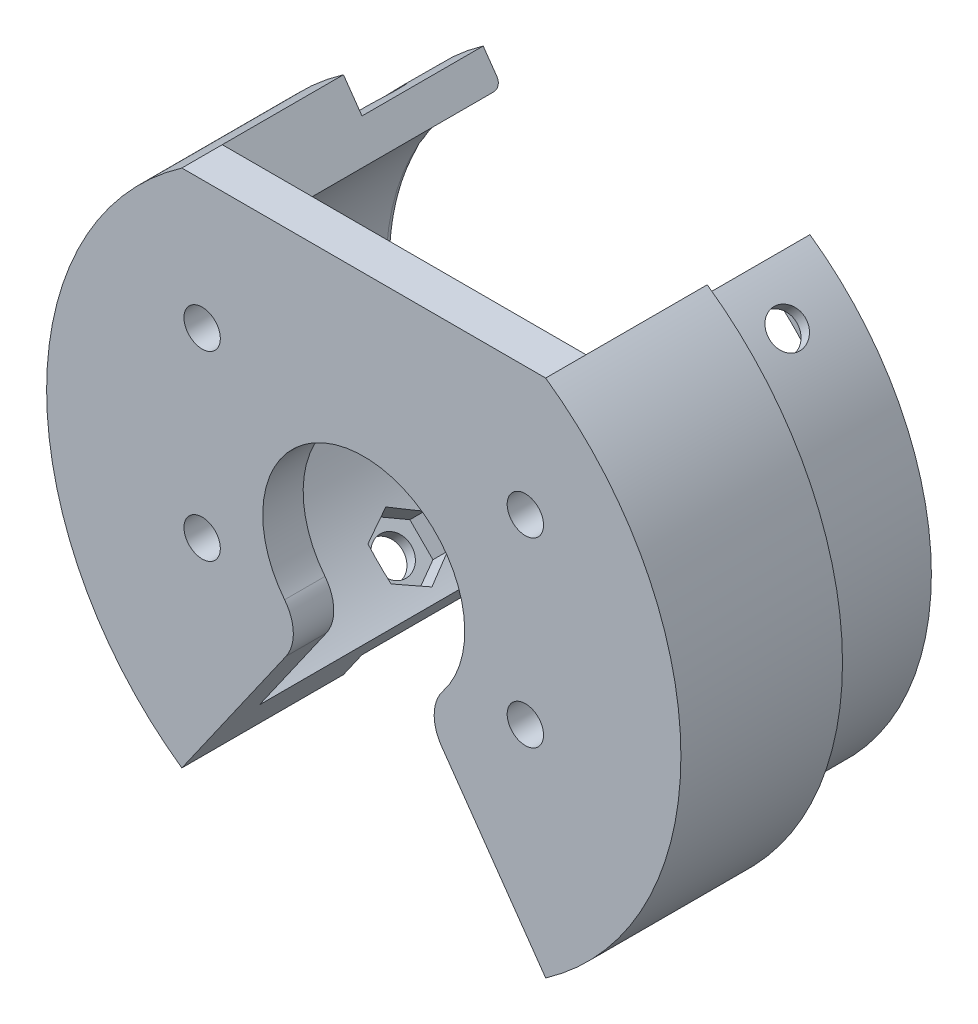
from build123d import *
from build123d.topology import SkipClean

# Parameters (mm, degrees)
SKETCH1_R               = 35.25
SKETCH1_R_2             = 31.25
BOSS_EXTRUDE1_DEPTH     = 7.5
CUT_EXTRUDE1_DEPTH      = 51.412052
BOSS_EXTRUDE2_DEPTH     = 15
BOSS_EXTRUDE3_DEPTH     = 5
CUT_EXTRUDE2_START      = -10
SKETCH8_R               = 2.25
CUT_EXTRUDE2_DEPTH      = 97.386619
CUT_EXTRUDE3_START      = -10
CUT_EXTRUDE3_DEPTH      = 12.5
MIRROR3_START           = -10
MIRROR3_COPY_1_SKETCH_R = 2.25
MIRROR3_COPY_1_DEPTH    = 97.386619
MIRROR3_COPY_2_DEPTH    = 12.5
CUT_EXTRUDE4_DEPTH      = 62.638425
CUT_EXTRUDE4_DEPTH_BACK = 62.638425
FILLET1_R               = 5
SKETCH11_R              = 2.25
EXAMPLE_MOUNT_DEPTH     = 62.638425
FILLET2_R               = 1


with BuildPart() as part:
    # Sketch1 → Boss-Extrude1 (new, symmetric)
    with BuildSketch(Plane.XY):
        Circle(SKETCH1_R)
        Circle(SKETCH1_R_2, mode=Mode.SUBTRACT)
    extrude(amount=BOSS_EXTRUDE1_DEPTH, both=True)

    # Sketch2 → Cut-Extrude1 (cut, symmetric)
    with BuildSketch(Plane.XY):
        with BuildLine():
            Line((20.218569, 28.87511), (17.924264, 25.598501))
            ThreePointArc((17.924264, 25.598501), (0, 31.25), (-17.924264, 25.598501))
            Line((-17.924264, 25.598501), (-20.218569, 28.87511))
            ThreePointArc((-20.218569, 28.87511), (0, 35.25), (20.218569, 28.87511))
        make_face()
    cut_extrude1 = extrude(amount=CUT_EXTRUDE1_DEPTH, both=True, mode=Mode.SUBTRACT)

    # Mirror1: Cut-Extrude1 across plane
    add(cut_extrude1.mirror(Plane.ZX), mode=Mode.SUBTRACT)

    # Sketch3 → Boss-Extrude2 (add)
    with SkipClean():  # the faces are left unmerged after this step: merging them gives an invalid solid
        with BuildSketch(Plane.XY.offset(7.5)):
            with BuildLine():
                Line((-17.924264, 25.598501), (-22.512875, 32.151718))
                ThreePointArc((-22.512875, 32.151718), (-39.25, 0), (-22.512875, -32.151718))
                Line((-22.512875, -32.151718), (-17.924264, -25.598501))
                ThreePointArc((-17.924264, -25.598501), (-31.25, 0), (-17.924264, 25.598501))
            make_face()
            with BuildLine():
                Line((17.924264, -25.598501), (22.512875, -32.151718))
                ThreePointArc((22.512875, -32.151718), (39.25, 0), (22.512875, 32.151718))
                Line((22.512875, 32.151718), (17.924264, 25.598501))
                ThreePointArc((17.924264, 25.598501), (31.25, 0), (17.924264, -25.598501))
            make_face()
        extrude(amount=BOSS_EXTRUDE2_DEPTH)

    # Sketch4 → Boss-Extrude3 (add)
    with SkipClean():  # the faces are left unmerged after this step: merging them gives an invalid solid
        with BuildSketch(Plane.XY.offset(22.5)):
            with BuildLine():
                Line((22.512875, 32.151718), (-22.512875, 32.151718))
                ThreePointArc((-22.512875, 32.151718), (-39.25, 0), (-22.512875, -32.151718))
                Line((-22.512875, -32.151718), (22.512875, -32.151718))
                ThreePointArc((22.512875, -32.151718), (39.25, 0), (22.512875, 32.151718))
            make_face()
        extrude(amount=BOSS_EXTRUDE3_DEPTH)

    # Sketch8 → Cut-Extrude2 (cut)
    with SkipClean():  # the faces are left unmerged after this step: merging them gives an invalid solid
        with BuildSketch(Plane(origin=(22.097087, 22.097087, 0), x_dir=(0.7071067811865486, -0.7071067811865465, 0), z_dir=(0.7071067811865465, 0.7071067811865486, 0)).offset(CUT_EXTRUDE2_START)):
            with Locations(Location((0, 0, 0), (0, 0, 180))):
                Circle(SKETCH8_R)
        cut_extrude2 = extrude(amount=CUT_EXTRUDE2_DEPTH, mode=Mode.SUBTRACT)

    # Sketch9 → Cut-Extrude3 (cut)
    with SkipClean():  # the faces are left unmerged after this step: merging them gives an invalid solid
        with BuildSketch(Plane(origin=(22.097087, 22.097087, 0), x_dir=(0.7071067811865486, -0.7071067811865465, 0), z_dir=(0.7071067811865465, 0.7071067811865486, 0)).offset(CUT_EXTRUDE3_START)):
            Polygon((2.020726, -3.5), (4.041452, 0), (2.020726, 3.5), (-2.020726, 3.5), (-4.041452, 0), (-2.020726, -3.5), align=None)
        cut_extrude3 = extrude(amount=CUT_EXTRUDE3_DEPTH, mode=Mode.SUBTRACT)

    # Mirror2: Cut-Extrude2, Cut-Extrude3 across plane
    with SkipClean():  # the faces are left unmerged after this step: merging them gives an invalid solid
        add(cut_extrude2.mirror(Plane.ZX), mode=Mode.SUBTRACT)
        add(cut_extrude3.mirror(Plane.ZX), mode=Mode.SUBTRACT)

    # Mirror3: Cut-Extrude2, Cut-Extrude3 across plane
    with SkipClean():  # the faces are left unmerged after this step: merging them gives an invalid solid
        add(cut_extrude2.mirror(Plane(origin=(0, 0, 0), x_dir=(0, 0, 1), z_dir=(1, 0, 0))), mode=Mode.SUBTRACT)
        add(cut_extrude3.mirror(Plane(origin=(0, 0, 0), x_dir=(0, 0, 1), z_dir=(1, 0, 0))), mode=Mode.SUBTRACT)

    # Mirror3 copy 1 sketch → Mirror3 copy 1 (cut)
    with SkipClean():  # the faces are left unmerged after this step: merging them gives an invalid solid
        with BuildSketch(Plane(origin=(-22.097087, -22.097087, 0), x_dir=(-0.7071067811865486, 0.7071067811865465, 0), z_dir=(-0.7071067811865465, -0.7071067811865486, 0)).offset(MIRROR3_START)):
            with Locations(Location((0, 0, 0), (0, 0, 180))):
                Circle(MIRROR3_COPY_1_SKETCH_R)
        extrude(amount=MIRROR3_COPY_1_DEPTH, mode=Mode.SUBTRACT)

    # Mirror3 copy 2 sketch → Mirror3 copy 2 (cut)
    with SkipClean():  # the faces are left unmerged after this step: merging them gives an invalid solid
        with BuildSketch(Plane(origin=(-22.097087, -22.097087, 0), x_dir=(-0.7071067811865486, 0.7071067811865465, 0), z_dir=(-0.7071067811865465, -0.7071067811865486, 0)).offset(MIRROR3_START)):
            Polygon((2.020726, -3.5), (4.041452, 0), (2.020726, 3.5), (-2.020726, 3.5), (-4.041452, 0), (-2.020726, -3.5), align=None)
        extrude(amount=MIRROR3_COPY_2_DEPTH, mode=Mode.SUBTRACT)

    # Sketch10 → Cut-Extrude4 (cut, two sides: drawn at the far end of the back side and taken through both)
    with SkipClean():  # the faces are left unmerged after this step: merging them gives an invalid solid
        with BuildSketch(Plane.XY.offset(27.5).offset(-CUT_EXTRUDE4_DEPTH_BACK)):
            with BuildLine():
                Line((-22.512875, -32.151718), (-7.169705, -10.239401))
                ThreePointArc((-7.169705, -10.239401), (0, 12.5), (7.169705, -10.239401))
                Line((7.169705, -10.239401), (22.512875, -32.151718))
                Line((22.512875, -32.151718), (-22.512875, -32.151718))
            make_face()
        extrude(amount=CUT_EXTRUDE4_DEPTH + CUT_EXTRUDE4_DEPTH_BACK, mode=Mode.SUBTRACT)

    # Fillet1
    fillet1_edges = [part.edges().sort_by_distance(p)[0] for p in [
        (-7.169705, -10.239401, 25),
        (7.169705, -10.239401, 25),
    ]]
    fillet(fillet1_edges, radius=FILLET1_R)

    # Sketch11 → example_mount (cut, through all)
    with SkipClean():  # the faces are left unmerged after this step: merging them gives an invalid solid
        with BuildSketch(Plane.XY.offset(27.5)):
            with Locations((-20, -6.25)):
                Circle(SKETCH11_R)
            with Locations((-20, 16.25)):
                Circle(SKETCH11_R)
            with Locations((20, 16.25)):
                Circle(SKETCH11_R)
            with Locations((20, -6.25)):
                Circle(SKETCH11_R)
        extrude(amount=-EXAMPLE_MOUNT_DEPTH, mode=Mode.SUBTRACT)

    # Fillet2
    fillet2_edges = [part.edges().sort_by_distance(p)[0] for p in [
        (-31.25, 0, -7.5),
        (31.25, 0, -7.5),
    ]]
    fillet(fillet2_edges, radius=FILLET2_R)


solid = part.part
